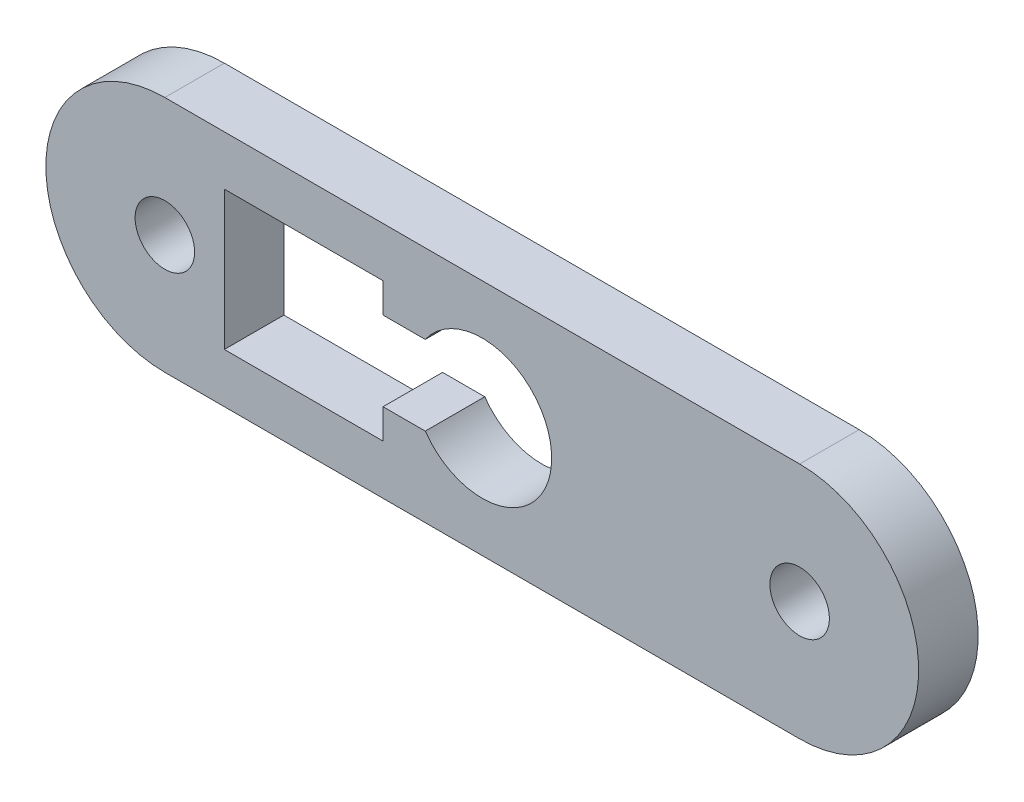
from build123d import *

# Parameters (mm, degrees)
SKETCH1_R           = 1.5
BOSS_EXTRUDE1_DEPTH = 3
CUT_EXTRUDE1_DEPTH  = 40.962482405


with BuildPart() as part:
    # Sketch1 → Boss-Extrude1 (new body)
    with BuildSketch(Plane.XY):
        with BuildLine():
            Line((0, 0), (32, 0))
            ThreePointArc((32, 0), (38, 6), (32, 12))
            Line((32, 12), (0, 12))
            ThreePointArc((0, 12), (-6, 6), (0, 0))
        make_face()
        with Locations((0, 6)):
            Circle(SKETCH1_R, mode=Mode.SUBTRACT)
        with Locations((32, 6)):
            Circle(SKETCH1_R, mode=Mode.SUBTRACT)
    extrude(amount=BOSS_EXTRUDE1_DEPTH)

    # Sketch2 → Cut-Extrude1 (cut, through all)
    with BuildSketch(Plane.XY.offset(3)):
        with BuildLine():
            Line((3, 9.5), (11, 9.5))
            Line((11, 9.5), (11, 8))
            Line((11, 8), (13.127718677, 8))
            ThreePointArc((13.127718677, 8), (19.5, 6), (13.127718677, 4))
            Line((13.127718677, 4), (11, 4))
            Line((11, 4), (11, 2.5))
            Line((11, 2.5), (3, 2.5))
            Line((3, 2.5), (3, 9.5))
        make_face()
    extrude(amount=-CUT_EXTRUDE1_DEPTH, mode=Mode.SUBTRACT)


solid = part.part
